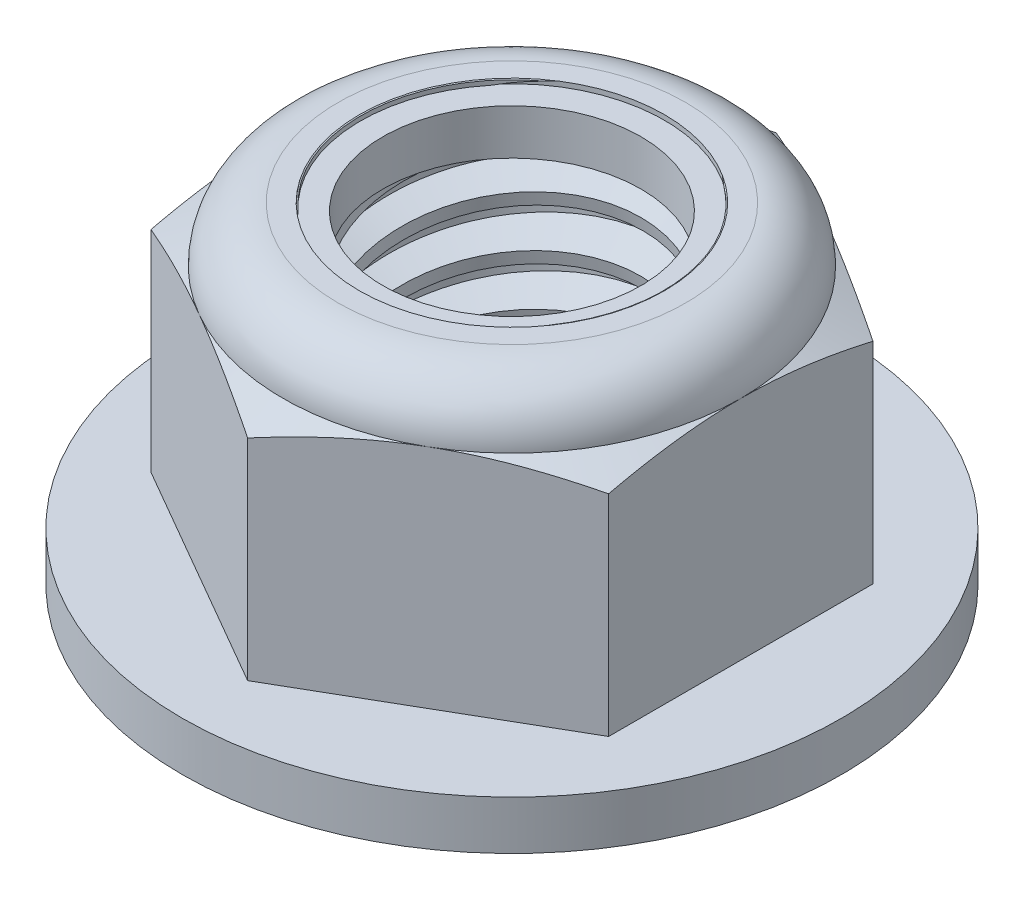
from build123d import *

# Parameters (mm, degrees)
EXTRUDE1_DEPTH      = 10.31875
SKETCH8_W           = 10.287
SKETCH8_H           = 1.524
SKETCH2_W           = 4.7625
SKETCH2_H           = 10.31875
LPATTERN1_COUNT     = 7
LPATTERN1_PITCH     = 1.5875
LPATTERN1_COL_COUNT = 2
LPATTERN1_COL_PITCH = 1.5875


with BuildPart() as part:
    # Sketch1 → Extrude1 (new body)
    with BuildSketch(Plane(origin=(0, 0, 0), x_dir=(1, 0, 0), z_dir=(0, 1, 0))):
        Polygon((0, 8.248891971), (-7.14375, 4.124445986), (-7.14375, -4.124445986), (0, -8.248891971), (7.14375, -4.124445986), (7.14375, 4.124445986), align=None)
    extrude(amount=EXTRUDE1_DEPTH)

    # Sketch8 → Revolve3 (revolve)
    with BuildSketch(Plane(origin=(0, 0, 0), x_dir=(0, 0, -1), z_dir=(1, 0, 0)), mode=Mode.PRIVATE) as revolve3_sk:
        with Locations((5.1435, 0.762)):
            Rectangle(SKETCH8_W, SKETCH8_H)
    revolve(revolve3_sk.sketch.rotate(Axis((0, 0, 0), (0, -1, 0)), 180), axis=Axis((0, 0, 0), (0, -1, 0)))

    # Sketch4 → Cut-Revolve2 (revolve, cut)
    with BuildSketch(Plane(origin=(0, 0, 0), x_dir=(0, 0, -1), z_dir=(1, 0, 0)), mode=Mode.PRIVATE) as cut_revolve2_sk:
        Polygon((0, 10.31875), (4.7625, 10.31875), (4.029111805, 9.976765468), (4.029111805, 0.341984532), (4.7625, 0), (0, 0), align=None)
    revolve(cut_revolve2_sk.sketch.rotate(Axis((0, 10.31875, 0), (0, 1, 0)), 55.157981045), axis=Axis((0, 10.31875, 0), (0, 1, 0)), mode=Mode.SUBTRACT)


with BuildPart() as body_2:
    # Sketch2 → Revolve1 (revolve)
    with BuildSketch(Plane(origin=(0, 0, 0), x_dir=(0, 0, -1), z_dir=(1, 0, 0))):
        with Locations((2.38125, 5.159375)):
            Rectangle(SKETCH2_W, SKETCH2_H)
    revolve(axis=Axis((0, -4.7625, 0), (0, 1, 0)))

    # Sketch3 → Cut-Revolve1 (revolve, cut)
    with BuildSketch(Plane(origin=(0, 0, 0), x_dir=(0, 0, -1), z_dir=(1, 0, 0)), mode=Mode.PRIVATE) as cut_revolve1_sk:
        Polygon((4.795122924, 10.123012456), (5.023483392, 8.752849646), (4.094357653, 9.100932102), (4.029111805, 9.49240719), align=None)
    cut_revolve1 = revolve(cut_revolve1_sk.sketch.rotate(Axis((0, 10.31875, 0.28317269), (0, -0.9863939238321436, -0.16439898730535787)), 180), axis=Axis((0, 10.31875, 0.28317269), (0, -0.9863939238321436, -0.16439898730535787)), mode=Mode.SUBTRACT)

    # LPattern1: Cut-Revolve1 ×7
    with Locations(*[(0, -i * LPATTERN1_PITCH, 0) for i in range(1, LPATTERN1_COUNT)]):
        add(cut_revolve1, mode=Mode.SUBTRACT)

    # LPattern1 col: Cut-Revolve1 ×2
    with Locations(*[(0, i * LPATTERN1_COL_PITCH, 0) for i in range(1, LPATTERN1_COL_COUNT)]):
        add(cut_revolve1, mode=Mode.SUBTRACT)


with BuildPart() as part_1:
    add(part.part)

    # Combine1: cut body 2
    add(body_2.part, mode=Mode.SUBTRACT)

    # Sketch5 → Cut-Revolve3 (revolve, cut)
    with BuildSketch(Plane(origin=(0, 0, 0), x_dir=(0, 0, -1), z_dir=(1, 0, 0)), mode=Mode.PRIVATE) as cut_revolve3_sk:
        with BuildLine():
            Line((8.248891971, 1.524), (8.248891971, 8.083622169))
            Line((8.248891971, 8.083622169), (7.14375, 8.598958333))
            ThreePointArc((7.14375, 8.598958333), (6.640034683, 9.815034683), (5.423958333, 10.31875))
            Line((5.423958333, 10.31875), (5.423958333, 11.58875))
            Line((5.423958333, 11.58875), (9.518891971, 11.58875))
            Line((9.518891971, 11.58875), (9.518891971, 1.524))
            Line((9.518891971, 1.524), (8.248891971, 1.524))
        make_face()
    revolve(cut_revolve3_sk.sketch.rotate(Axis((0, 0, 0), (0, 1, 0)), 55.157981045), axis=Axis((0, 0, 0), (0, 1, 0)), mode=Mode.SUBTRACT)

    # Sketch6 → Cut-Revolve4 (revolve, cut)
    with BuildSketch(Plane(origin=(0, 0, 0), x_dir=(0, 0, -1), z_dir=(1, 0, 0)), mode=Mode.PRIVATE) as cut_revolve4_sk:
        with BuildLine():
            Line((0, 8.598958333), (6.99135, 8.598958333))
            ThreePointArc((6.99135, 8.598958333), (6.53227161, 9.70727161), (5.423958333, 10.16635))
            Line((5.423958333, 10.16635), (4.726535069, 10.16635))
            Line((4.726535069, 10.16635), (4.726535069, 11.58875))
            Line((4.726535069, 11.58875), (0, 11.58875))
            Line((0, 11.58875), (0, 8.598958333))
        make_face()
    revolve(cut_revolve4_sk.sketch.rotate(Axis((0, 11.58875, 0), (0, 1, 0)), 55.157981045), axis=Axis((0, 11.58875, 0), (0, 1, 0)), mode=Mode.SUBTRACT)


with BuildPart() as body_2_2:
    # Sketch7 → Revolve2 (revolve)
    with BuildSketch(Plane(origin=(0, 0, 0), x_dir=(0, 0, -1), z_dir=(1, 0, 0)), mode=Mode.PRIVATE) as revolve2_sk:
        with BuildLine():
            Line((4.029111805, 8.675158333), (6.913201815, 8.675158333))
            ThreePointArc((6.913201815, 8.675158333), (6.451096051, 9.679995195), (5.423958333, 10.09015))
            Line((5.423958333, 10.09015), (4.029111805, 10.09015))
            Line((4.029111805, 10.09015), (4.029111805, 8.675158333))
        make_face()
    revolve(revolve2_sk.sketch.rotate(Axis((0, 8.675158333, 0), (0, 1, 0)), 47.227985619), axis=Axis((0, 8.675158333, 0), (0, 1, 0)))


solid = Compound([part_1.part, body_2_2.part])
